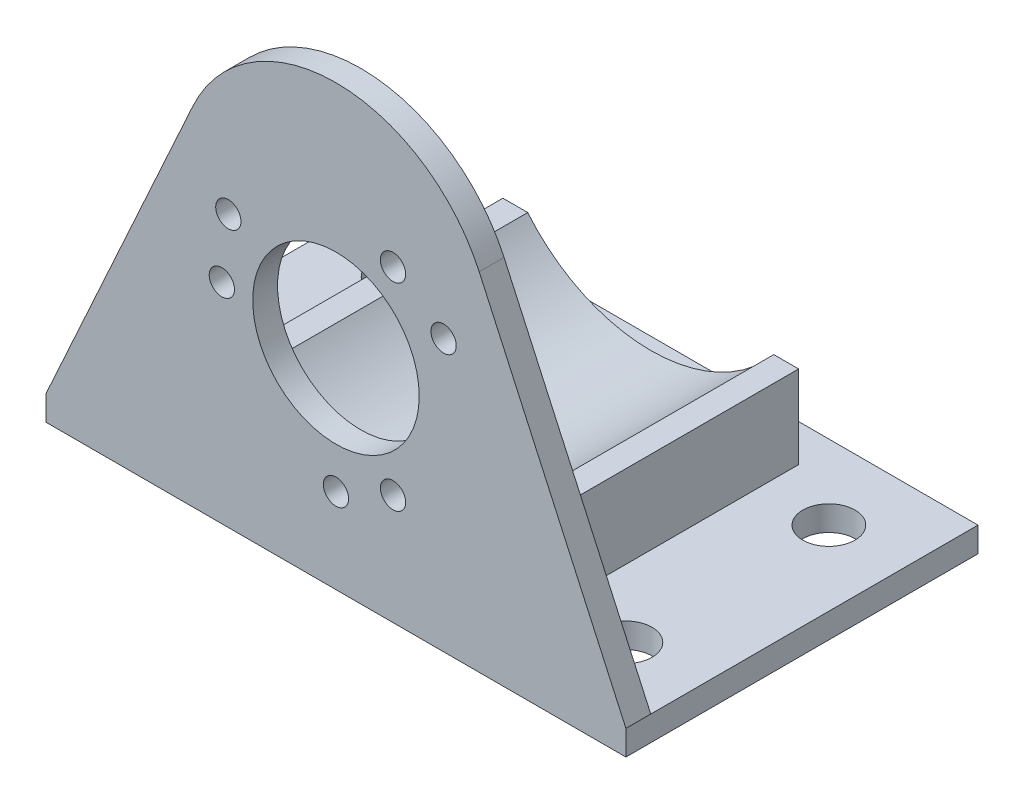
from build123d import *

# Parameters (mm, degrees)
SKETCH3_W           = 70
SKETCH3_H           = 42.5
BOSS_EXTRUDE1_DEPTH = 3
SKETCH4_R           = 10.05
SKETCH4_R_2         = 1.525
BOSS_EXTRUDE2_DEPTH = 3
BOSS_EXTRUDE3_DEPTH = 35
SKETCH6_R           = 3.15
CUT_EXTRUDE1_DEPTH  = 5


with BuildPart() as part:
    # Sketch3 → Boss-Extrude1 (new body)
    with BuildSketch(Plane(origin=(0, 0, 0), x_dir=(1, 0, 0), z_dir=(0, 1, 0))):
        Rectangle(SKETCH3_W, SKETCH3_H)
    extrude(amount=BOSS_EXTRUDE1_DEPTH)

    # Sketch4 → Boss-Extrude2 (add)
    with BuildSketch(Plane.XY.offset(21.25)):
        with BuildLine():
            Line((-35, 3), (-17.290526546, 41.876400939))
            ThreePointArc((-17.290526546, 41.876400939), (0, 53), (17.290526546, 41.876400939))
            Line((17.290526546, 41.876400939), (35, 3))
            Line((35, 3), (-35, 3))
        make_face()
        with Locations((0, 25.25)):
            Circle(SKETCH4_R, mode=Mode.SUBTRACT)
        with Locations((-13.774757254, 25.25)):
            Circle(SKETCH4_R_2, mode=Mode.SUBTRACT)
        with Locations((-12.990381057, 32.75)):
            Circle(SKETCH4_R_2, mode=Mode.SUBTRACT)
        with Locations((12.990381057, 32.75)):
            Circle(SKETCH4_R_2, mode=Mode.SUBTRACT)
        with Locations((6.887378627, 37.179289713)):
            Circle(SKETCH4_R_2, mode=Mode.SUBTRACT)
        with Locations((0, 10.25)):
            Circle(SKETCH4_R_2, mode=Mode.SUBTRACT)
        with Locations((6.887378627, 13.320710287)):
            Circle(SKETCH4_R_2, mode=Mode.SUBTRACT)
    extrude(amount=-BOSS_EXTRUDE2_DEPTH)

    # Sketch5 → Boss-Extrude3 (add)
    with BuildSketch(Plane(origin=(0, 0, 18.25), x_dir=(-1, 0, 0), z_dir=(0, 0, -1))):
        with BuildLine():
            Line((-17.849242405, 13), (-17.849242405, 3))
            Line((-17.849242405, 3), (17.849242405, 3))
            Line((17.849242405, 3), (17.849242405, 13))
            Line((17.849242405, 13), (14.849242405, 13))
            ThreePointArc((14.849242405, 13), (0, 6), (-14.849242405, 13))
            Line((-14.849242405, 13), (-17.849242405, 13))
        make_face()
    extrude(amount=BOSS_EXTRUDE3_DEPTH)

    # Sketch6 → Cut-Extrude1 (cut)
    with BuildSketch(Plane(origin=(0, 3, 0), x_dir=(1, 0, 0), z_dir=(0, 1, 0))):
        with Locations(Location((-26, 12.25, 0), (0, 0, 270))):
            Circle(SKETCH6_R)
        with Locations(Location((26, 12.25, 0), (0, 0, 270))):
            Circle(SKETCH6_R)
        with Locations(Location((26, -12.25, 0), (0, 0, 270))):
            Circle(SKETCH6_R)
        with Locations(Location((-26, -12.25, 0), (0, 0, 270))):
            Circle(SKETCH6_R)
    extrude(amount=-CUT_EXTRUDE1_DEPTH, mode=Mode.SUBTRACT)


solid = part.part
